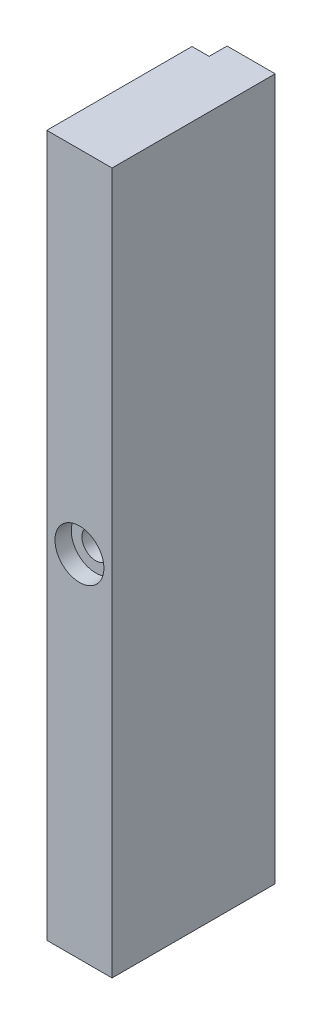
from build123d import *

# Parameters (mm, degrees)
MAIN_PROFILE_SKETCH_W     = 8
MAIN_PROFILE_SKETCH_H     = 86
MAIN_PROFILE_SKETCH_R     = 3
MAIN_EXTRUSION_DEPTH      = 2
DETAIL_PROFILE_2_SKETCH_W = 8
DETAIL_PROFILE_2_SKETCH_H = 86
DETAIL_PROFILE_2_SKETCH_R = 1.7
DETAIL_EXTRUSION_2_DEPTH  = 15.8
DETAIL_PROFILE_3_SKETCH_W = 5.9
DETAIL_PROFILE_3_SKETCH_H = 86
DETAIL_PROFILE_3_SKETCH_R = 1.7
DETAIL_EXTRUSION_3_DEPTH  = 2.2


with BuildPart() as part:
    # Main Profile Sketch → Main Extrusion (new body)
    with BuildSketch(Plane.XY.offset(140)):
        with Locations((-151.5, 0)):
            Rectangle(MAIN_PROFILE_SKETCH_W, MAIN_PROFILE_SKETCH_H)
        with Locations((-151.5, 0)):
            Circle(MAIN_PROFILE_SKETCH_R, mode=Mode.SUBTRACT)
    extrude(amount=-MAIN_EXTRUSION_DEPTH)

    # Detail Profile 2 Sketch → Detail Extrusion 2 (add)
    with BuildSketch(Plane.XY.offset(138)):
        with Locations((-151.5, 0)):
            Rectangle(DETAIL_PROFILE_2_SKETCH_W, DETAIL_PROFILE_2_SKETCH_H)
        with Locations((-151.5, 0)):
            Circle(DETAIL_PROFILE_2_SKETCH_R, mode=Mode.SUBTRACT)
    extrude(amount=-DETAIL_EXTRUSION_2_DEPTH)

    # Detail Profile 3 Sketch → Detail Extrusion 3 (add)
    with BuildSketch(Plane.XY.offset(122.2)):
        with Locations((-150.45, 0)):
            Rectangle(DETAIL_PROFILE_3_SKETCH_W, DETAIL_PROFILE_3_SKETCH_H)
        with Locations((-151.5, 0)):
            Circle(DETAIL_PROFILE_3_SKETCH_R, mode=Mode.SUBTRACT)
    extrude(amount=-DETAIL_EXTRUSION_3_DEPTH)


solid = part.part
